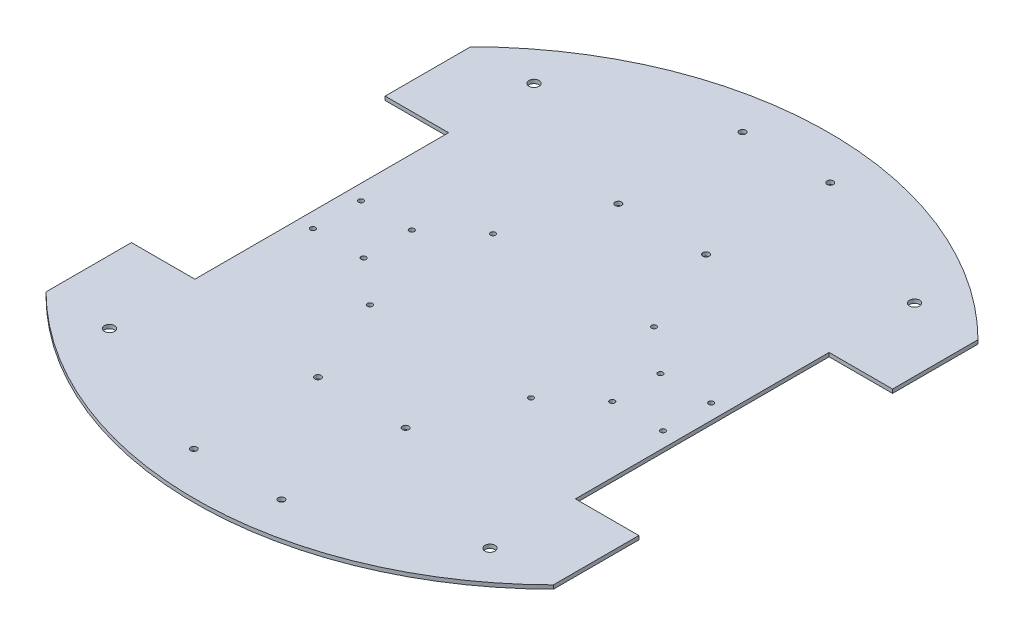
from build123d import *

# Parameters (mm, degrees)
BOSS_EXTRUDE1_DEPTH = 3
SKETCH3_R           = 2
CUT_EXTRUDE5_DEPTH  = 10
SKETCH4_R           = 4
CUT_EXTRUDE6_DEPTH  = 10
SKETCH6_R           = 2
CUT_EXTRUDE7_DEPTH  = 10
SKETCH8_R           = 2.5
CUT_EXTRUDE8_DEPTH  = 55


with BuildPart() as part:
    # Sketch2 → Boss-Extrude1 (new body)
    with BuildSketch(Plane(origin=(0, 0, 0), x_dir=(1, 0, 0), z_dir=(0, 1, 0))):
        with BuildLine():
            Line((2.81621534, -115.073455489), (52.81621534, -115.073455489))
            Line((52.81621534, -115.073455489), (52.81621534, -315.073455489))
            Line((52.81621534, -315.073455489), (2.81621534, -315.073455489))
            Line((2.81621534, -315.073455489), (2.81621534, -382.433365135))
            ThreePointArc((2.81621534, -382.433365135), (202.81621534, -465.073455489), (402.81621534, -382.433365135))
            Line((402.81621534, -382.433365135), (402.81621534, -315.073455489))
            Line((402.81621534, -315.073455489), (352.81621534, -315.073455489))
            Line((352.81621534, -315.073455489), (352.81621534, -115.073455489))
            Line((352.81621534, -115.073455489), (402.81621534, -115.073455489))
            Line((402.81621534, -115.073455489), (402.81621534, -47.713545842))
            ThreePointArc((402.81621534, -47.713545842), (202.81621534, 34.926544511), (2.81621534, -47.713545842))
            Line((2.81621534, -47.713545842), (2.81621534, -115.073455489))
        make_face()
    extrude(amount=BOSS_EXTRUDE1_DEPTH)

    # Sketch3 → Cut-Extrude5 (cut)
    with BuildSketch(Plane(origin=(0, 3, 0), x_dir=(1, 0, 0), z_dir=(0, 1, 0))):
        with Locations(Location((64.81621534, -196.073455489, 0), (0, 0, 270))):
            Circle(SKETCH3_R)
        with Locations(Location((104.81621534, -196.073455489, 0), (0, 0, 270))):
            Circle(SKETCH3_R)
        with Locations(Location((104.81621534, -234.073455489, 0), (0, 0, 90))):
            Circle(SKETCH3_R)
        with Locations(Location((64.81621534, -234.073455489, 0), (0, 0, 90))):
            Circle(SKETCH3_R)
        with Locations(Location((340.81621534, -234.073455489, 0), (0, 0, 270))):
            Circle(SKETCH3_R)
        with Locations(Location((300.81621534, -234.073455489, 0), (0, 0, 270))):
            Circle(SKETCH3_R)
        with Locations(Location((300.81621534, -196.073455489, 0), (0, 0, 90))):
            Circle(SKETCH3_R)
        with Locations(Location((340.81621534, -196.073455489, 0), (0, 0, 90))):
            Circle(SKETCH3_R)
    extrude(amount=-CUT_EXTRUDE5_DEPTH, mode=Mode.SUBTRACT)

    # Sketch4 → Cut-Extrude6 (cut)
    with BuildSketch(Plane(origin=(0, 3, 0), x_dir=(1, 0, 0), z_dir=(0, 1, 0))):
        with Locations(Location((52.81621534, -47.713545842, 0), (0, 0, 270))):
            Circle(SKETCH4_R)
        with Locations(Location((352.81621534, -47.713545842, 0), (0, 0, 90))):
            Circle(SKETCH4_R)
        with Locations(Location((352.81621534, -382.433365135, 0), (0, 0, 270))):
            Circle(SKETCH4_R)
        with Locations(Location((52.81621534, -382.433365135, 0), (0, 0, 90))):
            Circle(SKETCH4_R)
    extrude(amount=-CUT_EXTRUDE6_DEPTH, mode=Mode.SUBTRACT)

    # Sketch6 → Cut-Extrude7 (cut)
    with BuildSketch(Plane(origin=(0, 3, 0), x_dir=(1, 0, 0), z_dir=(0, 1, 0))):
        with Locations(Location((139.31621534, -263.573455489, 0), (0, 0, 270))):
            Circle(SKETCH6_R)
        with Locations(Location((139.31621534, -166.573455489, 0), (0, 0, 270))):
            Circle(SKETCH6_R)
        with Locations(Location((266.31621534, -166.573455489, 0), (0, 0, 270))):
            Circle(SKETCH6_R)
        with Locations(Location((266.31621534, -263.573455489, 0), (0, 0, 270))):
            Circle(SKETCH6_R)
    extrude(amount=-CUT_EXTRUDE7_DEPTH, mode=Mode.SUBTRACT)

    # Sketch8 → Cut-Extrude8 (cut)
    with BuildSketch(Plane(origin=(0, 3, 0), x_dir=(1, 0, 0), z_dir=(0, 1, 0))):
        with Locations(Location((168.25621534, -333.473365135, 0), (0, 0, 270))):
            Circle(SKETCH8_R)
        with Locations(Location((237.37621534, -333.473365135, 0), (0, 0, 270))):
            Circle(SKETCH8_R)
        with Locations(Location((237.37621534, -431.393365135, 0), (0, 0, 270))):
            Circle(SKETCH8_R)
        with Locations(Location((168.25621534, -431.393365135, 0), (0, 0, 270))):
            Circle(SKETCH8_R)
        with Locations(Location((168.25621534, 1.246454158, 0), (0, 0, 90))):
            Circle(SKETCH8_R)
        with Locations(Location((237.37621534, 1.246454158, 0), (0, 0, 90))):
            Circle(SKETCH8_R)
        with Locations(Location((237.37621534, -96.673545842, 0), (0, 0, 90))):
            Circle(SKETCH8_R)
        with Locations(Location((168.25621534, -96.673545842, 0), (0, 0, 90))):
            Circle(SKETCH8_R)
    extrude(amount=-CUT_EXTRUDE8_DEPTH, mode=Mode.SUBTRACT)


solid = part.part
